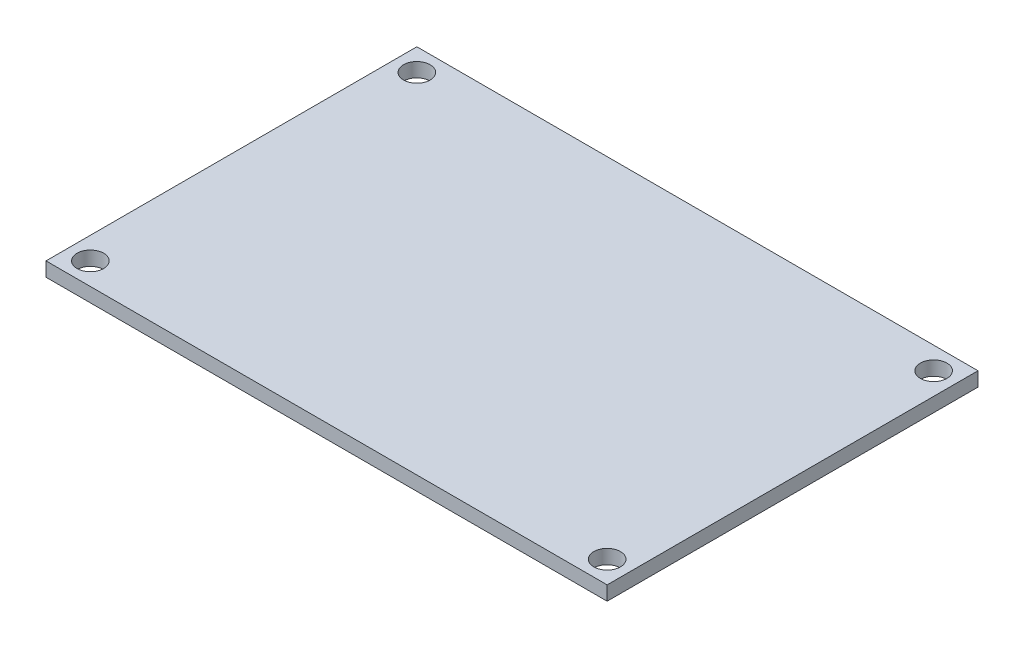
from build123d import *

# Parameters (mm, degrees)
SKETCH1_W           = 63.25
SKETCH1_H           = 41.8
SKETCH1_R           = 1.5
BOSS_EXTRUDE1_DEPTH = 1.6


with BuildPart() as part:
    # Sketch1 → Boss-Extrude1 (new body)
    with BuildSketch(Plane(origin=(0, 0, 0), x_dir=(1, 0, 0), z_dir=(0, 1, 0))):
        Rectangle(SKETCH1_W, SKETCH1_H)
        with Locations(Location((-29.125, 18.4, 0), (0, 0, 270))):
            Circle(SKETCH1_R, mode=Mode.SUBTRACT)
        with Locations(Location((29.125, 18.4, 0), (0, 0, 90))):
            Circle(SKETCH1_R, mode=Mode.SUBTRACT)
        with Locations(Location((29.125, -18.4, 0), (0, 0, 270))):
            Circle(SKETCH1_R, mode=Mode.SUBTRACT)
        with Locations(Location((-29.125, -18.4, 0), (0, 0, 90))):
            Circle(SKETCH1_R, mode=Mode.SUBTRACT)
    extrude(amount=BOSS_EXTRUDE1_DEPTH)


solid = part.part
